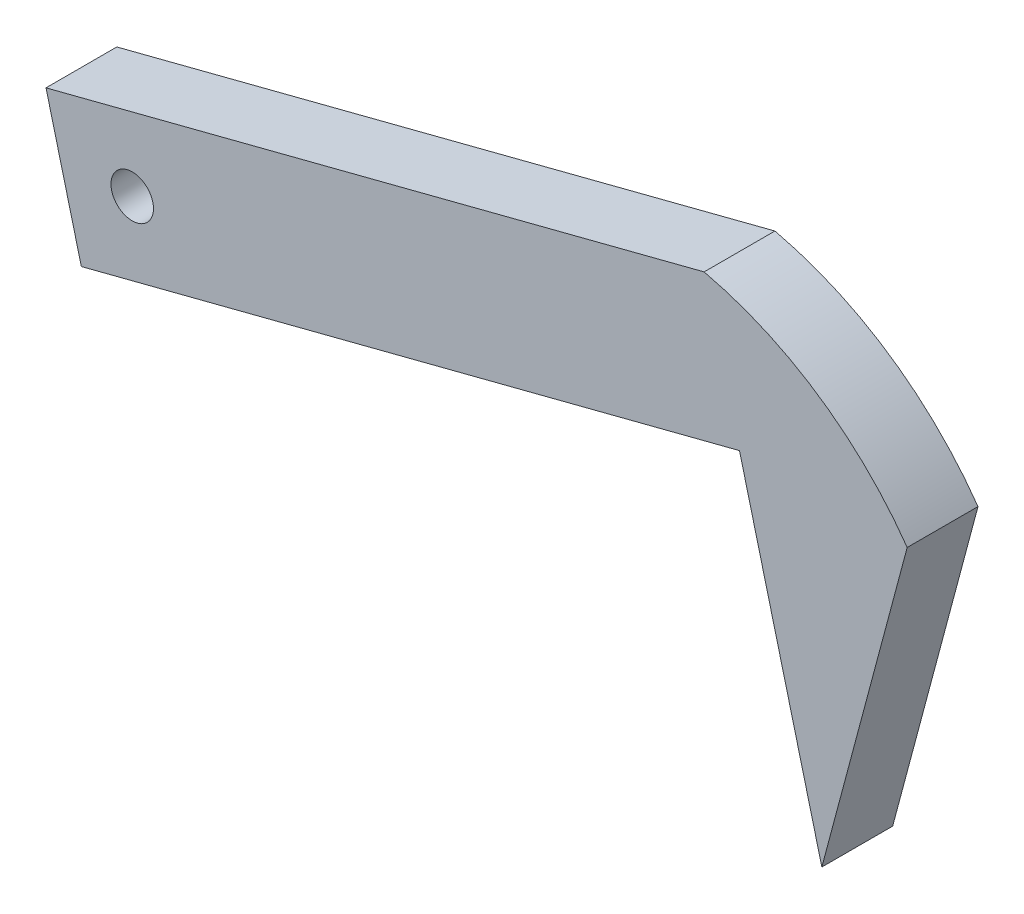
from build123d import *

# Parameters (mm, degrees)
ESQUISSE1_R        = 1.5
BOSS_EXTRU_1_DEPTH = 5


with BuildPart() as part:
    # Esquisse1 → Boss.-Extru.1 (new body)
    with BuildSketch(Plane.XY):
        with BuildLine():
            Line((60.821746164, 2.298556296), (54.792957694, -20.26386127))
            Line((54.792957694, -20.26386127), (48.976694855, 2.298556296))
            Line((48.976694855, 2.298556296), (2.496246467, -9.683426747))
            Line((2.496246467, -9.683426747), (0, 0))
            Line((0, 0), (46.480448388, 11.981983043))
            ThreePointArc((46.480448388, 11.981983043), (54.542604676, 8.460605272), (60.821746164, 2.298556296))
        make_face()
        with Locations((6.089836607, -3.59359014)):
            Circle(ESQUISSE1_R, mode=Mode.SUBTRACT)
    extrude(amount=BOSS_EXTRU_1_DEPTH)


solid = part.part
